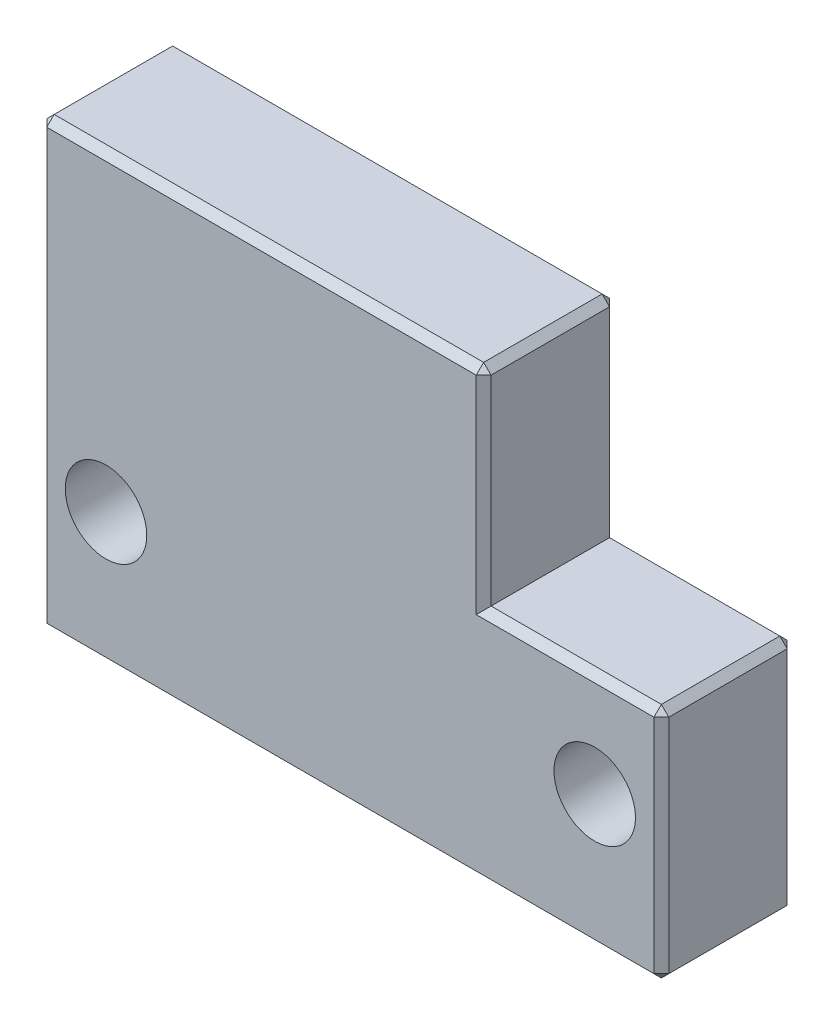
from build123d import *

# Parameters (mm, degrees)
SKETCH_1_W          = 42
SKETCH_1_H          = 30
EXTRUDE_1_DEPTH     = 9
SKETCH_2_W          = 12
SKETCH_2_H          = 14
CUT_EXTRUDE_1_DEPTH = 53.39274759
CHAMFER_1_SIZE      = 0.5
SKETCH_3_R          = 2.75
CUT_EXTRUDE_2_DEPTH = 53.39274759


with BuildPart() as part:
    # 草图1 → 凸台-拉伸1 (new body)
    with BuildSketch(Plane.XY):
        with Locations((21, 15)):
            Rectangle(SKETCH_1_W, SKETCH_1_H)
    extrude(amount=EXTRUDE_1_DEPTH)

    # 草图2 → 切除-拉伸1 (cut, through all)
    with BuildSketch(Plane(origin=(0, 0, 0), x_dir=(-1, 0, 0), z_dir=(0, 0, -1))):
        with Locations((-36, 23)):
            Rectangle(SKETCH_2_W, SKETCH_2_H)
    extrude(amount=-CUT_EXTRUDE_1_DEPTH, mode=Mode.SUBTRACT)

    # 倒角1
    chamfer_1_edges = [part.edges().sort_by_distance(p)[0] for p in [
        (42, 8, 9),
        (15, 30, 0),
        (15, 30, 9),
        (42, 16, 4.5),
        (30, 23, 9),
        (30, 30, 4.5),
        (36, 16, 9),
        (36, 16, 0),
        (30, 23, 0),
        (0, 15, 9),
        (42, 8, 0),
        (21, 0, 0),
        (0, 15, 0),
        (21, 0, 9),
        (0, 30, 4.5),
        (42, 0, 4.5),
        (0, 0, 4.5),
    ]]
    chamfer(chamfer_1_edges, length=CHAMFER_1_SIZE)

    # 草图3 → 切除-拉伸2 (cut, through all)
    with BuildSketch(Plane(origin=(0, 0, 0), x_dir=(-1, 0, 0), z_dir=(0, 0, -1))):
        with Locations((-37.5, 9)):
            Circle(SKETCH_3_R)
        with Locations((-4.5, 9)):
            Circle(SKETCH_3_R)
    extrude(amount=-CUT_EXTRUDE_2_DEPTH, mode=Mode.SUBTRACT)


solid = part.part
